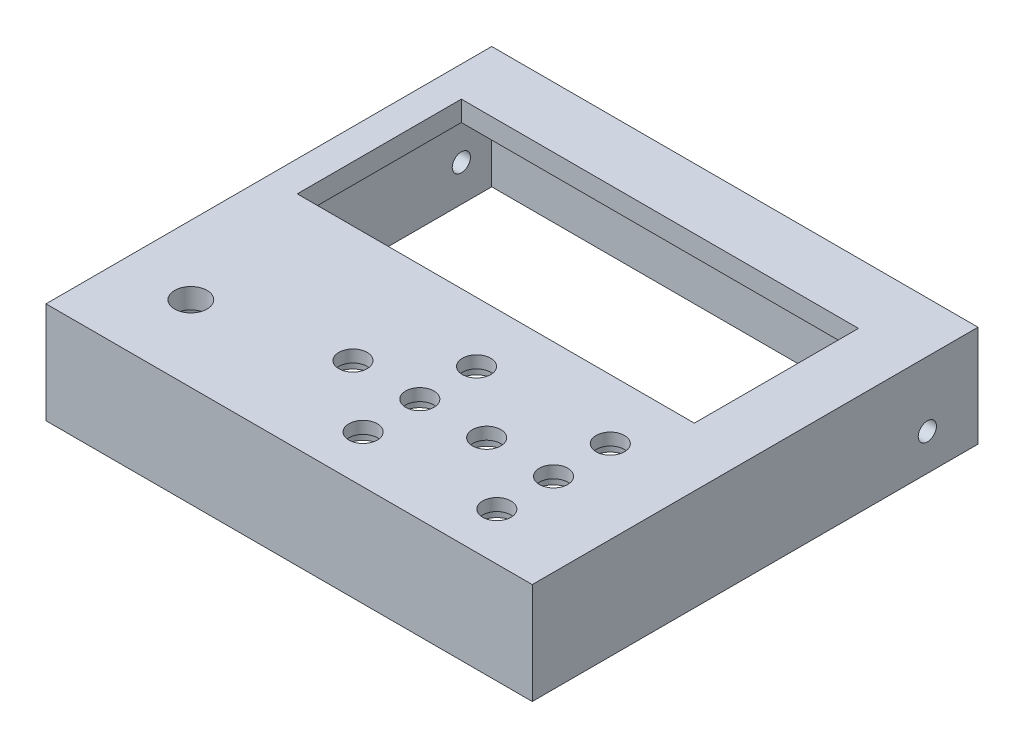
from build123d import *

# Parameters (mm, degrees)
SKETCH1_W           = 120
SKETCH1_H           = 110
SKETCH1_W_2         = 98
SKETCH1_H_2         = 40.5
BOSS_EXTRUDE1_DEPTH = 5
SKETCH2_R           = 1.25
CUT_EXTRUDE1_DEPTH  = 4
SKETCH3_R           = 3.5
CUT_EXTRUDE2_DEPTH  = 99.208006293
SKETCH4_R           = 4
CUT_EXTRUDE3_DEPTH  = 99.208006293
SKETCH5_R           = 4.5
CUT_EXTRUDE4_DEPTH  = 2
SKETCH6_W           = 120
SKETCH6_H           = 110
SKETCH6_W_2         = 110
SKETCH6_H_2         = 101
BOSS_EXTRUDE3_DEPTH = 20
SKETCH7_R           = 2.25
CUT_EXTRUDE5_DEPTH  = 143.785021974
BOSS_EXTRUDE5_START = 4
SKETCH9_R           = 1.25
BOSS_EXTRUDE5_DEPTH = 4
BOSS_EXTRUDE6_START = 11
SKETCH10_R          = 1.25
BOSS_EXTRUDE6_DEPTH = 11
BOSS_EXTRUDE7_DEPTH = 4


with BuildPart() as part:
    # Sketch1 → Boss-Extrude1 (new body)
    with BuildSketch(Plane(origin=(0, 0, 0), x_dir=(1, 0, 0), z_dir=(0, 1, 0))):
        with Locations((3.5, -19.75)):
            Rectangle(SKETCH1_W, SKETCH1_H)
        Rectangle(SKETCH1_W_2, SKETCH1_H_2, mode=Mode.SUBTRACT)
    extrude(amount=BOSS_EXTRUDE1_DEPTH)

    # Sketch2 → Cut-Extrude1 (cut)
    with BuildSketch(Plane.XZ):
        with Locations(Location((-46.5, 27.5, 0), (0, 0, 270))):
            Circle(SKETCH2_R)
        with Locations(Location((46.5, 27.5, 0), (0, 0, 270))):
            Circle(SKETCH2_R)
        with Locations(Location((46.5, -27.5, 0), (0, 0, 270))):
            Circle(SKETCH2_R)
        with Locations(Location((-46.5, -27.5, 0), (0, 0, 270))):
            Circle(SKETCH2_R)
        with Locations(Location((-46.5, 33.5, 0), (0, 0, 270))):
            Circle(SKETCH2_R)
        with Locations(Location((50.5, 33.5, 0), (0, 0, 270))):
            Circle(SKETCH2_R)
        with Locations(Location((50.5, 66.5, 0), (0, 0, 270))):
            Circle(SKETCH2_R)
        with Locations(Location((-46.5, 66.5, 0), (0, 0, 270))):
            Circle(SKETCH2_R)
    extrude(amount=-CUT_EXTRUDE1_DEPTH, mode=Mode.SUBTRACT)

    # Sketch3 → Cut-Extrude2 (cut, through all)
    with BuildSketch(Plane(origin=(0, 5, 0), x_dir=(1, 0, 0), z_dir=(0, 1, 0))):
        with Locations(Location((43, -35, 0), (0, 0, 270))):
            Circle(SKETCH3_R)
        with Locations(Location((43, -49, 0), (0, 0, 270))):
            Circle(SKETCH3_R)
        with Locations(Location((43, -63, 0), (0, 0, 270))):
            Circle(SKETCH3_R)
        with Locations(Location((26.5, -49, 0), (0, 0, 270))):
            Circle(SKETCH3_R)
        with Locations(Location((10, -49, 0), (0, 0, 270))):
            Circle(SKETCH3_R)
        with Locations(Location((10, -35, 0), (0, 0, 270))):
            Circle(SKETCH3_R)
        with Locations(Location((10, -63, 0), (0, 0, 270))):
            Circle(SKETCH3_R)
        with Locations(Location((-6.5, -49, 0), (0, 0, 270))):
            Circle(SKETCH3_R)
    extrude(amount=-CUT_EXTRUDE2_DEPTH, mode=Mode.SUBTRACT)

    # Sketch4 → Cut-Extrude3 (cut, through all)
    with BuildSketch(Plane(origin=(0, 5, 0), x_dir=(1, 0, 0), z_dir=(0, 1, 0))):
        with Locations(Location((-39.5, -56, 0), (0, 0, 270))):
            Circle(SKETCH4_R)
    extrude(amount=-CUT_EXTRUDE3_DEPTH, mode=Mode.SUBTRACT)

    # Sketch5 → Cut-Extrude4 (cut)
    with BuildSketch(Plane.XZ):
        with Locations(Location((43, 63, 0), (0, 0, 270))):
            Circle(SKETCH5_R)
        with Locations(Location((43, 49, 0), (0, 0, 270))):
            Circle(SKETCH5_R)
        with Locations(Location((43, 35, 0), (0, 0, 270))):
            Circle(SKETCH5_R)
        with Locations(Location((26.5, 49, 0), (0, 0, 270))):
            Circle(SKETCH5_R)
        with Locations(Location((10, 49, 0), (0, 0, 270))):
            Circle(SKETCH5_R)
        with Locations(Location((10, 35, 0), (0, 0, 270))):
            Circle(SKETCH5_R)
        with Locations(Location((-6.5, 49, 0), (0, 0, 270))):
            Circle(SKETCH5_R)
        with Locations(Location((10, 63, 0), (0, 0, 270))):
            Circle(SKETCH5_R)
    extrude(amount=-CUT_EXTRUDE4_DEPTH, mode=Mode.SUBTRACT)

    # Sketch6 → Boss-Extrude3 (add)
    with BuildSketch(Plane.XZ):
        with Locations((3.5, 19.75)):
            Rectangle(SKETCH6_W, SKETCH6_H)
        with Locations((3.5, 20.25)):
            Rectangle(SKETCH6_W_2, SKETCH6_H_2, mode=Mode.SUBTRACT)
    extrude(amount=BOSS_EXTRUDE3_DEPTH)

    # Sketch7 → Cut-Extrude5 (cut, through all)
    with BuildSketch(Plane(origin=(63.5, 0, 0), x_dir=(0, 0, -1), z_dir=(1, 0, 0))):
        with Locations((22.75, -11)):
            Circle(SKETCH7_R)
    extrude(amount=-CUT_EXTRUDE5_DEPTH, mode=Mode.SUBTRACT)

    # Sketch9 → Boss-Extrude5 (add)
    # profile 1 of 4: a face of its own
    with BuildSketch(Plane.XZ.offset(BOSS_EXTRUDE5_START)):
        with BuildLine():
            Line((-51.5, 30.625), (-46.5, 30.625))
            ThreePointArc((-46.5, 30.625), (-43.375, 27.5), (-46.5, 24.375))
            Line((-46.5, 24.375), (-51.5, 24.375))
            Line((-51.5, 24.375), (-51.5, 30.625))
        make_face()
        with Locations(Location((-46.5, 27.5, 0), (0, 0, 270))):
            Circle(SKETCH9_R, mode=Mode.SUBTRACT)
    # profile 2 of 4: a face of its own
    with BuildSketch(Plane.XZ.offset(BOSS_EXTRUDE5_START)):
        with BuildLine():
            Line((46.5, 30.625), (58.5, 30.625))
            ThreePointArc((58.5, 30.625), (61.625, 27.5), (58.5, 24.375))
            Line((58.5, 24.375), (46.5, 24.375))
            ThreePointArc((46.5, 24.375), (43.375, 27.5), (46.5, 30.625))
        make_face()
        with Locations(Location((46.5, 27.5, 0), (0, 0, 270))):
            Circle(SKETCH9_R, mode=Mode.SUBTRACT)
    # profile 3 of 4: a face of its own
    with BuildSketch(Plane.XZ.offset(BOSS_EXTRUDE5_START)):
        with BuildLine():
            Line((-51.5, -24.375), (-46.5, -24.375))
            ThreePointArc((-46.5, -24.375), (-44.290291309, -25.290291309), (-43.375, -27.5))
            Line((-43.375, -27.5), (-43.375, -30.25))
            Line((-43.375, -30.25), (-51.5, -30.25))
            Line((-51.5, -30.25), (-51.5, -24.375))
        make_face()
        with Locations(Location((-46.5, -27.5, 0), (0, 0, 270))):
            Circle(SKETCH9_R, mode=Mode.SUBTRACT)
    # profile 4 of 4: a face of its own
    with BuildSketch(Plane.XZ.offset(BOSS_EXTRUDE5_START)):
        with BuildLine():
            Line((43.375, -30.25), (43.375, -27.5))
            ThreePointArc((43.375, -27.5), (44.290291309, -25.290291309), (46.5, -24.375))
            Line((46.5, -24.375), (58.5, -24.375))
            Line((58.5, -24.375), (58.5, -30.25))
            Line((58.5, -30.25), (43.375, -30.25))
        make_face()
        with Locations(Location((46.5, -27.5, 0), (0, 0, 270))):
            Circle(SKETCH9_R, mode=Mode.SUBTRACT)
    extrude(amount=-BOSS_EXTRUDE5_DEPTH)

    # Sketch10 → Boss-Extrude6 (add)
    # profile 1 of 4: a face of its own
    with BuildSketch(Plane.XZ.offset(BOSS_EXTRUDE6_START)):
        with BuildLine():
            Line((-46.5, 30.625), (-51.5, 30.625))
            ThreePointArc((-51.5, 30.625), (-54.375, 33.5), (-51.5, 36.375))
            Line((-51.5, 36.375), (-46.5, 36.375))
            ThreePointArc((-46.5, 36.375), (-43.625, 33.5), (-46.5, 30.625))
        make_face()
        with Locations(Location((-46.5, 33.5, 0), (0, 0, 270))):
            Circle(SKETCH10_R, mode=Mode.SUBTRACT)
    # profile 2 of 4: a face of its own
    with BuildSketch(Plane.XZ.offset(BOSS_EXTRUDE6_START)):
        with BuildLine():
            Line((50.5, 36.375), (58.5, 36.375))
            ThreePointArc((58.5, 36.375), (61.375, 33.5), (58.5, 30.625))
            Line((58.5, 30.625), (50.5, 30.625))
            ThreePointArc((50.5, 30.625), (47.625, 33.5), (50.5, 36.375))
        make_face()
        with Locations(Location((50.5, 33.5, 0), (0, 0, 270))):
            Circle(SKETCH10_R, mode=Mode.SUBTRACT)
    # profile 3 of 4: a face of its own
    with BuildSketch(Plane.XZ.offset(BOSS_EXTRUDE6_START)):
        with BuildLine():
            Line((-51.5, 63.625), (-46.5, 63.625))
            ThreePointArc((-46.5, 63.625), (-44.467068004, 64.467068004), (-43.625, 66.5))
            Line((-43.625, 66.5), (-43.625, 70.75))
            Line((-43.625, 70.75), (-51.5, 70.75))
            Line((-51.5, 70.75), (-51.5, 63.625))
        make_face()
        with Locations(Location((-46.5, 66.5, 0), (0, 0, 270))):
            Circle(SKETCH10_R, mode=Mode.SUBTRACT)
    # profile 4 of 4: a face of its own
    with BuildSketch(Plane.XZ.offset(BOSS_EXTRUDE6_START)):
        with BuildLine():
            Line((47.625, 70.75), (47.625, 66.5))
            ThreePointArc((47.625, 66.5), (48.467068004, 64.467068004), (50.5, 63.625))
            Line((50.5, 63.625), (58.5, 63.625))
            Line((58.5, 63.625), (58.5, 70.75))
            Line((58.5, 70.75), (47.625, 70.75))
        make_face()
        with Locations(Location((50.5, 66.5, 0), (0, 0, 270))):
            Circle(SKETCH10_R, mode=Mode.SUBTRACT)
    extrude(amount=-BOSS_EXTRUDE6_DEPTH)

    # Sketch11 → Boss-Extrude7 (add)
    with BuildSketch(Plane.XZ):
        Polygon((-43.625, 33.5), (-43.375, 27.5), (-46.5, 30.625), align=None)
        with BuildLine():
            Line((47.625, 33.5), (50.5, 30.625))
            Line((50.5, 30.625), (45.463150289, 30.447976879))
            ThreePointArc((45.463150289, 30.447976879), (47.029785086, 31.629943897), (47.625, 33.5))
        make_face()
    extrude(amount=BOSS_EXTRUDE7_DEPTH)


solid = part.part
